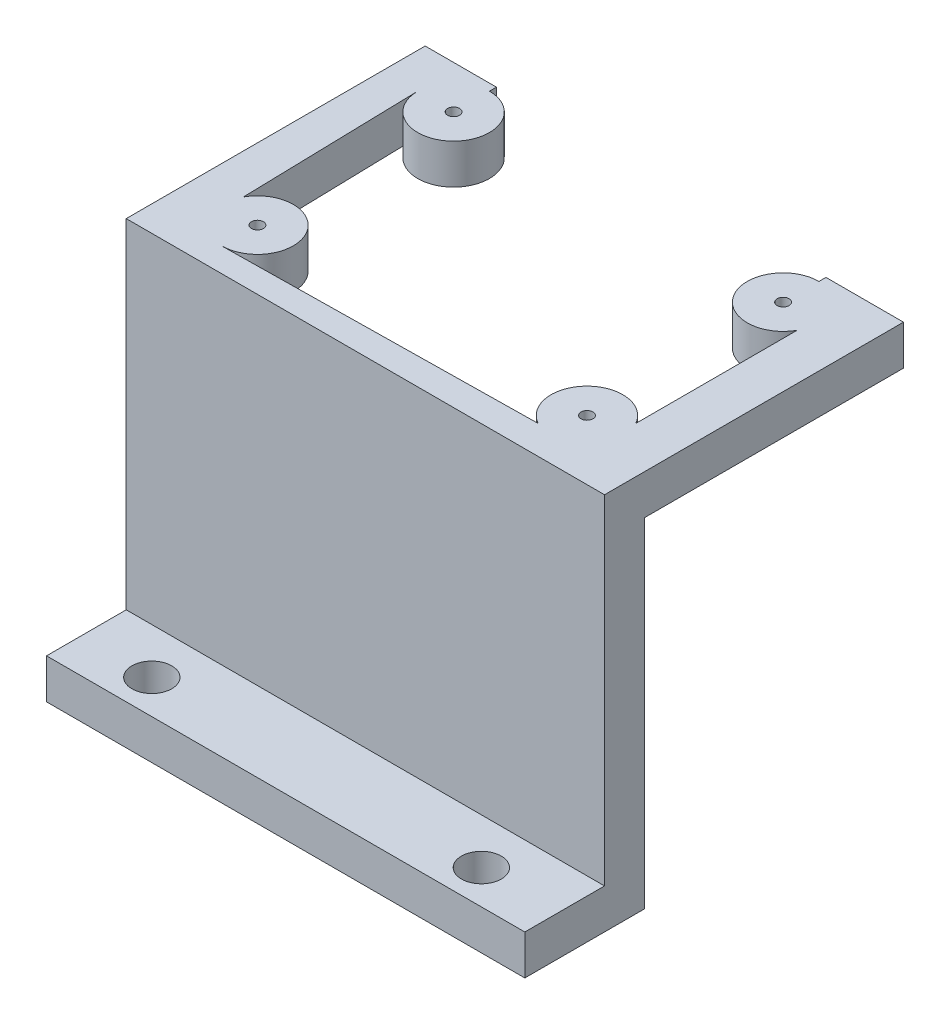
from build123d import *

# Parameters (mm, degrees)
BOSS_EXTRUDE1_DEPTH = 30.48
CUT_EXTRUDE1_DEPTH  = 2.54
SKETCH3_R           = 0.381
SKETCH3_R_2         = 1.27
CUT_EXTRUDE2_DEPTH  = 30.48


with BuildPart() as part:
    # Sketch1 → Boss-Extrude1 (new body)
    with BuildSketch(Plane(origin=(0, 0, 0), x_dir=(0, 0, -1), z_dir=(1, 0, 0))):
        Polygon((0, 0), (7.62, 0), (7.62, 21.59), (24.13, 21.59), (24.13, 24.13), (5.08, 24.13), (5.08, 2.54), (0, 2.54), align=None)
    extrude(amount=BOSS_EXTRUDE1_DEPTH)

    # Sketch2 → Cut-Extrude1 (cut)
    with BuildSketch(Plane(origin=(0, 24.13, 0), x_dir=(1, 0, 0), z_dir=(0, 1, 0))):
        with BuildLine():
            Line((2.254723608, 21.342486419), (2.54, 10.007156719))
            ThreePointArc((2.54, 10.007156719), (6.500958303, 10.074920649), (4.572889679, 6.614236611))
            Line((4.572889679, 6.614236611), (24.432843281, 6.9))
            ThreePointArc((24.432843281, 6.9), (23.923553898, 10.516446102), (27.54, 10.007156719))
            Line((27.54, 10.007156719), (27.54, 20.292843281))
            ThreePointArc((27.54, 20.292843281), (23.570640173, 20.2392167), (25.54, 23.686))
            Line((25.54, 23.686), (25.54, 25.581417478))
            Line((25.54, 25.581417478), (4.54, 25.84529962))
            Line((4.54, 25.84529962), (4.54, 23.686))
            ThreePointArc((4.54, 23.686), (6.176653911, 19.804017551), (2.254723608, 21.342486419))
        make_face()
    extrude(amount=-CUT_EXTRUDE1_DEPTH, mode=Mode.SUBTRACT)

    # Sketch3 → Cut-Extrude2 (cut)
    with BuildSketch(Plane(origin=(0, 24.13, 0), x_dir=(1, 0, 0), z_dir=(0, 1, 0))):
        with Locations(Location((4.54, 8.9, 0), (0, 0, 270))):
            Circle(SKETCH3_R)
        with Locations(Location((4.54, 21.4, 0), (0, 0, 270))):
            Circle(SKETCH3_R)
        with Locations(Location((25.54, 21.4, 0), (0, 0, 270))):
            Circle(SKETCH3_R)
        with Locations(Location((25.54, 8.9, 0), (0, 0, 270))):
            Circle(SKETCH3_R)
        with Locations(Location((4.54, 2.169828056, 0), (0, 0, 270))):
            Circle(SKETCH3_R_2)
        with Locations(Location((25.54, 2.169828056, 0), (0, 0, 270))):
            Circle(SKETCH3_R_2)
    extrude(amount=-CUT_EXTRUDE2_DEPTH, mode=Mode.SUBTRACT)


solid = part.part
